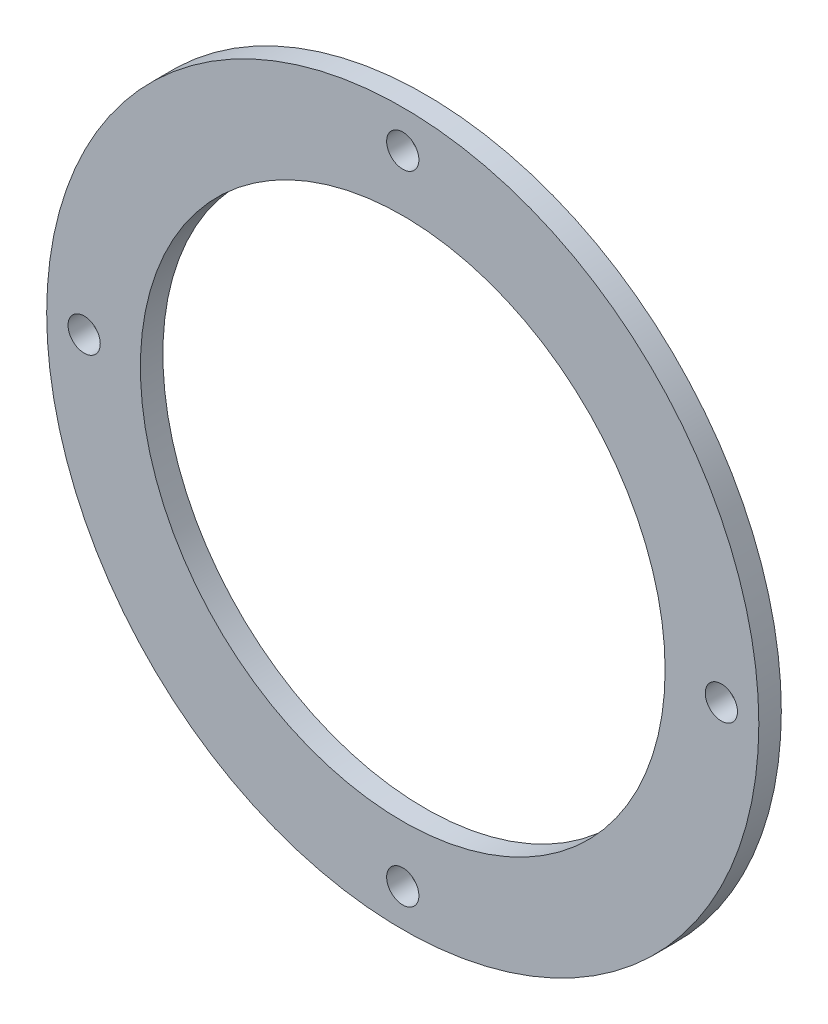
from build123d import *

# Parameters (mm, degrees)
SKETCH_1_R          = 47.5
SKETCH_1_R_2        = 35
EXTRUDE_1_DEPTH     = 3
CUT_EXTRUDE_1_REACH = 69.242
SKETCH_2_R          = 2.15


with BuildPart() as part:
    # 草图1 → 凸台-拉伸1 (new body)
    with BuildSketch(Plane.XY):
        Circle(SKETCH_1_R)
        Circle(SKETCH_1_R_2, mode=Mode.SUBTRACT)
    extrude(amount=EXTRUDE_1_DEPTH)

    # 草图2 → 切除-拉伸1 (cut, up to next)
    with BuildSketch(Plane.XY.offset(3), mode=Mode.PRIVATE) as cut_extrude_1_sk1:
        with Locations((42.5, 0)):
            Circle(SKETCH_2_R)
    cut_extrude_1_tool1 = extrude(cut_extrude_1_sk1.sketch, amount=-CUT_EXTRUDE_1_REACH, mode=Mode.PRIVATE) & part.part
    # 草图2 → 切除-拉伸1 (cut, up to next)
    with BuildSketch(Plane.XY.offset(3), mode=Mode.PRIVATE) as cut_extrude_1_sk2:
        with Locations((0, -42.5)):
            Circle(SKETCH_2_R)
    cut_extrude_1_tool2 = extrude(cut_extrude_1_sk2.sketch, amount=-CUT_EXTRUDE_1_REACH, mode=Mode.PRIVATE) & part.part
    # 草图2 → 切除-拉伸1 (cut, up to next)
    with BuildSketch(Plane.XY.offset(3), mode=Mode.PRIVATE) as cut_extrude_1_sk3:
        with Locations((-42.5, 0)):
            Circle(SKETCH_2_R)
    cut_extrude_1_tool3 = extrude(cut_extrude_1_sk3.sketch, amount=-CUT_EXTRUDE_1_REACH, mode=Mode.PRIVATE) & part.part
    # 草图2 → 切除-拉伸1 (cut, up to next)
    with BuildSketch(Plane.XY.offset(3), mode=Mode.PRIVATE) as cut_extrude_1_sk4:
        with Locations((0, 42.5)):
            Circle(SKETCH_2_R)
    cut_extrude_1_tool4 = extrude(cut_extrude_1_sk4.sketch, amount=-CUT_EXTRUDE_1_REACH, mode=Mode.PRIVATE) & part.part
    add(cut_extrude_1_tool1.solids().sort_by_distance((42.5, 0, 3))[0], mode=Mode.SUBTRACT)
    add(cut_extrude_1_tool2.solids().sort_by_distance((0, -42.5, 3))[0], mode=Mode.SUBTRACT)
    add(cut_extrude_1_tool3.solids().sort_by_distance((-42.5, 0, 3))[0], mode=Mode.SUBTRACT)
    add(cut_extrude_1_tool4.solids().sort_by_distance((0, 42.5, 3))[0], mode=Mode.SUBTRACT)


solid = part.part
